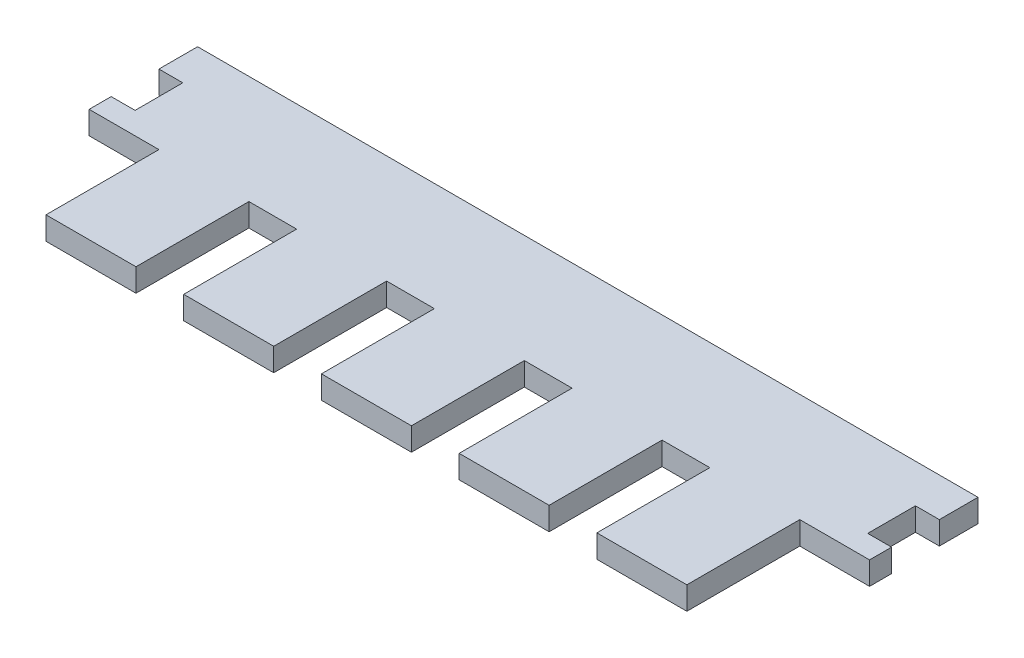
from build123d import *

# Parameters (mm, degrees)
SKETCH1_W           = 215.9
SKETCH1_H           = 57.15
BOSS_EXTRUDE1_DEPTH = 6.35
SKETCH3_W           = 24.892
SKETCH3_H           = 31.242
BOSS_EXTRUDE2_DEPTH = 6.35
SKETCH4_W           = 13.208
SKETCH4_H           = 13.208
CUT_EXTRUDE2_DEPTH  = 124.578309136
SKETCH5_W           = 279.767575851
SKETCH5_H           = 12.7
CUT_EXTRUDE3_DEPTH  = 124.578309136
SKETCH6_W           = 215.9
SKETCH6_H           = 14.45
CUT_EXTRUDE4_DEPTH  = 124.578309136


with BuildPart() as part:
    # Sketch1 → Boss-Extrude1 (new body)
    with BuildSketch(Plane(origin=(0, 0, 0), x_dir=(1, 0, 0), z_dir=(0, 1, 0))):
        Rectangle(SKETCH1_W, SKETCH1_H)
    extrude(amount=BOSS_EXTRUDE1_DEPTH)

    # Sketch3 → Boss-Extrude2 (add)
    with BuildSketch(Plane(origin=(0, 0, 0), x_dir=(1, 0, 0), z_dir=(0, 1, 0))):
        with Locations((-76.2, -44.196)):
            Rectangle(SKETCH3_W, SKETCH3_H)
        with Locations((-38.1, -44.196)):
            Rectangle(SKETCH3_W, SKETCH3_H)
        with Locations((0, -44.196)):
            Rectangle(SKETCH3_W, SKETCH3_H)
        with Locations((38.1, -44.196)):
            Rectangle(SKETCH3_W, SKETCH3_H)
        with Locations((76.2, -44.196)):
            Rectangle(SKETCH3_W, SKETCH3_H)
    extrude(amount=BOSS_EXTRUDE2_DEPTH)

    # Sketch4 → Cut-Extrude2 (cut, through all)
    with BuildSketch(Plane(origin=(0, 0, 0), x_dir=(1, 0, 0), z_dir=(0, 1, 0))):
        with Locations((-107.95, 9.525)):
            Rectangle(SKETCH4_W, SKETCH4_H)
        with Locations((-107.95, -15.875)):
            Rectangle(SKETCH4_W, SKETCH4_H)
        with Locations((107.95, -15.875)):
            Rectangle(SKETCH4_W, SKETCH4_H)
        with Locations((107.95, 9.525)):
            Rectangle(SKETCH4_W, SKETCH4_H)
    extrude(amount=CUT_EXTRUDE2_DEPTH, mode=Mode.SUBTRACT)

    # Sketch5 → Cut-Extrude3 (cut, through all)
    with BuildSketch(Plane(origin=(0, 6.35, 0), x_dir=(1, 0, 0), z_dir=(0, 1, 0))):
        with Locations((31.933787926, 22.225)):
            Rectangle(SKETCH5_W, SKETCH5_H)
    extrude(amount=-CUT_EXTRUDE3_DEPTH, mode=Mode.SUBTRACT)

    # Sketch6 → Cut-Extrude4 (cut, through all)
    with BuildSketch(Plane(origin=(0, 6.35, 0), x_dir=(1, 0, 0), z_dir=(0, 1, 0))):
        with Locations((0, 8.65)):
            Rectangle(SKETCH6_W, SKETCH6_H)
    extrude(amount=-CUT_EXTRUDE4_DEPTH, mode=Mode.SUBTRACT)


solid = part.part
